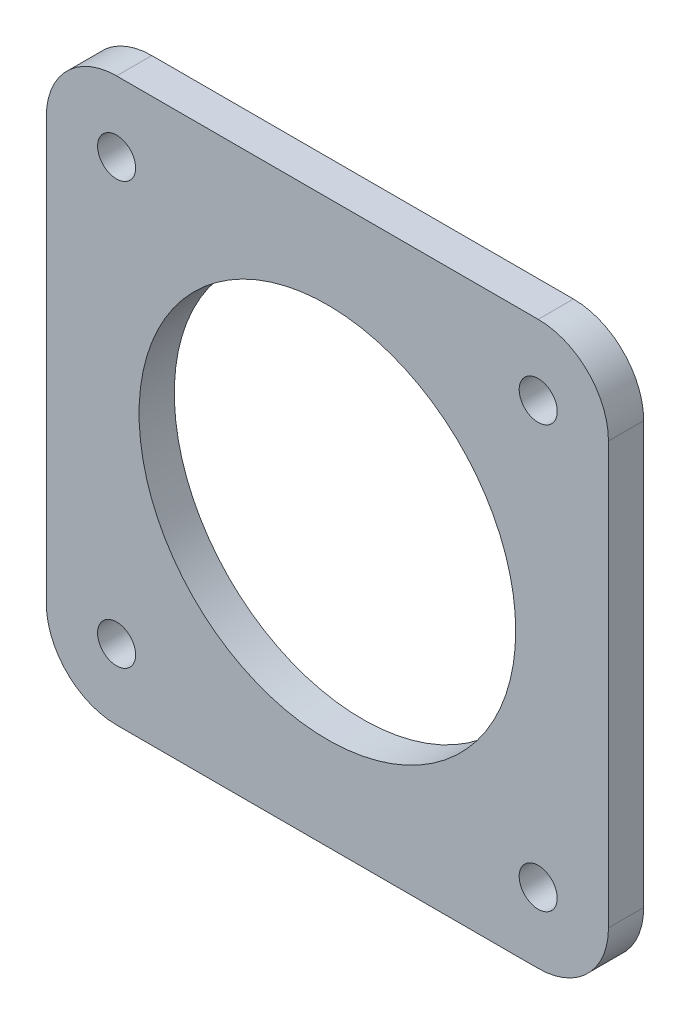
from build123d import *

# Parameters (mm, degrees)
SKETCH1_R      = 25.527
SKETCH1_R_2    = 2.5781
EXTRUDE1_DEPTH = 4.7752


with BuildPart() as part:
    # Sketch1 → Extrude1 (new body)
    with BuildSketch(Plane.XY):
        with BuildLine():
            Line((-28.575, 38.1), (28.575, 38.1))
            ThreePointArc((28.575, 38.1), (35.310192091, 35.310192091), (38.1, 28.575))
            Line((38.1, 28.575), (38.1, -28.575))
            ThreePointArc((38.1, -28.575), (35.310192091, -35.310192091), (28.575, -38.1))
            Line((28.575, -38.1), (-28.575, -38.1))
            ThreePointArc((-28.575, -38.1), (-35.310192091, -35.310192091), (-38.1, -28.575))
            Line((-38.1, -28.575), (-38.1, 28.575))
            ThreePointArc((-38.1, 28.575), (-35.310192091, 35.310192091), (-28.575, 38.1))
        make_face()
        Circle(SKETCH1_R, mode=Mode.SUBTRACT)
        with Locations((-28.575, 28.575)):
            Circle(SKETCH1_R_2, mode=Mode.SUBTRACT)
        with Locations(Location((28.575, 28.575, 0), (0, 0, 180))):
            Circle(SKETCH1_R_2, mode=Mode.SUBTRACT)
        with Locations(Location((-28.575, -28.575, 0), (0, 0, 180))):
            Circle(SKETCH1_R_2, mode=Mode.SUBTRACT)
        with Locations((28.575, -28.575)):
            Circle(SKETCH1_R_2, mode=Mode.SUBTRACT)
    extrude(amount=-EXTRUDE1_DEPTH)


solid = part.part
